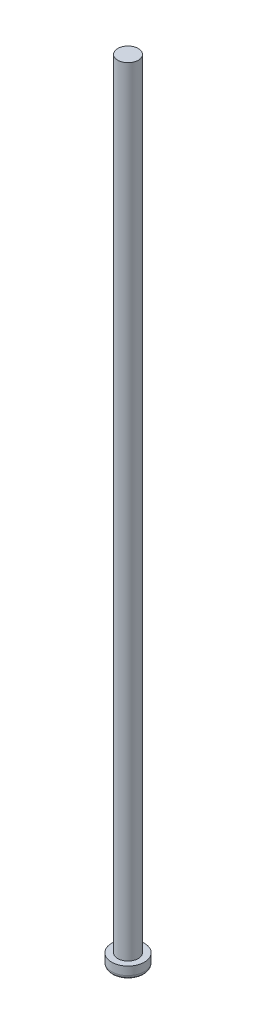
from build123d import *

# Parameters (mm, degrees)
SKETCH_1_R      = 2.5
EXTRUDE_1_DEPTH = 190
SKETCH_2_R      = 4
EXTRUDE_2_DEPTH = 3
FILLET_1_R      = 1


with BuildPart() as part:
    # 草图1 → 凸台-拉伸1 (new body)
    with BuildSketch(Plane(origin=(0, 0, 0), x_dir=(1, 0, 0), z_dir=(0, 1, 0))):
        with Locations(Location((0, 0, 0), (0, 0, 270))):
            Circle(SKETCH_1_R)
    extrude(amount=EXTRUDE_1_DEPTH)

    # 草图2 → 凸台-拉伸2 (add)
    with BuildSketch(Plane.XZ):
        with Locations(Location((0, 0, 0), (0, 0, 270))):
            Circle(SKETCH_2_R)
    extrude(amount=EXTRUDE_2_DEPTH)

    # 圆角1
    fillet_1_edges = [part.edges().sort_by_distance(p)[0] for p in [
        (0, -3, 4),
    ]]
    fillet(fillet_1_edges, radius=FILLET_1_R)


solid = part.part
